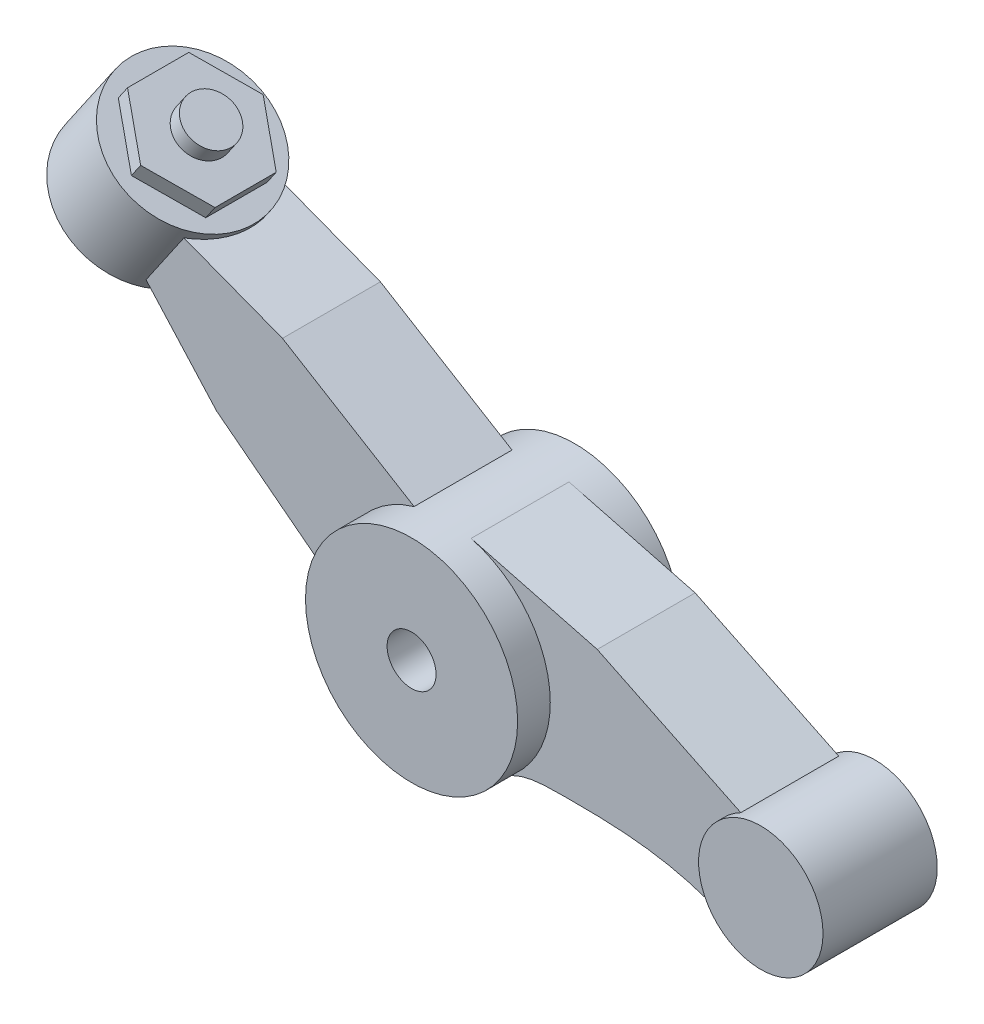
from build123d import *

# Parameters (mm, degrees)
SKETCH1_R           = 0.3
BOSS_EXTRUDE1_DEPTH = 1
BOSS_EXTRUDE2_DEPTH = 0.7
BOSS_EXTRUDE3_DEPTH = 0.6
BOSS_EXTRUDE4_DEPTH = 0.6
BOSS_EXTRUDE5_DEPTH = 0.2
SKETCH5_R           = 0.3
BOSS_EXTRUDE6_DEPTH = 0.2


with BuildPart() as part:
    # Sketch1 → Boss-Extrude1 (new, symmetric)
    with BuildSketch(Plane.XY):
        with BuildLine():
            ThreePointArc((1.3, 0), (1.02910885, 0.794314153), (0.329330809, 1.257593423))
            ThreePointArc((0.329330809, 1.257593423), (-0.020477848, 1.299838705), (-0.368782161, 1.24659525))
            ThreePointArc((-0.368782161, 1.24659525), (-1.071749439, 0.735767042), (-1.295848634, -0.103809043))
            ThreePointArc((-1.295848634, -0.103809043), (-0.542880941, -1.181219829), (0.765101997, -1.051008532))
            ThreePointArc((0.765101997, -1.051008532), (1.158583747, -0.5896471), (1.3, 0))
        make_face()
        Circle(SKETCH1_R, mode=Mode.SUBTRACT)
    extrude(amount=BOSS_EXTRUDE1_DEPTH, both=True)



with BuildPart() as body_2:
    # Sketch1<3> → Boss-Extrude2 (new, symmetric)
    with BuildSketch(Plane.XY):
        with BuildLine():
            ThreePointArc((4.7425, -0.68), (4.378976485, -0.030212331), (3.635027175, 0))
            ThreePointArc((3.635027175, 0), (3.227898468, -0.554502849), (3.432931907, -1.211152286))
            ThreePointArc((3.432931907, -1.211152286), (4.266589278, -1.386592411), (4.7425, -0.68))
        make_face()
    extrude(amount=BOSS_EXTRUDE2_DEPTH, both=True)


with BuildPart() as part_1:
    add(part.part)

    add(body_2.part)  # Boss-Extrude3 merges body 2
    # Sketch1<4> → Boss-Extrude3 (add, symmetric)
    with BuildSketch(Plane.XY):
        with BuildLine():
            ThreePointArc((3.432931907, -1.211152286), (3.227898468, -0.554502849), (3.635027175, 0))
            Line((3.635027175, 0), (1.875255399, 0.852756227))
            Line((1.875255399, 0.852756227), (0.329330809, 1.257593423))
            ThreePointArc((0.329330809, 1.257593423), (1.02910885, 0.794314153), (1.3, 0))
            ThreePointArc((1.3, 0), (1.158583747, -0.5896471), (0.765101997, -1.051008532))
            add(Edge.make_bspline(
                [(3.432931907, -1.211152286), (2.782696134, -0.927463912), (1.92467005, -0.895659575), (0.949941147, -0.916451296), (0.765101997, -1.051008532)],
                knots=[0, 0, 0, 0, 0.749641012, 1, 1, 1, 1], degree=3))
        make_face()
    extrude(amount=BOSS_EXTRUDE3_DEPTH, both=True)

    # Sketch1<5> → Boss-Extrude4 (add, symmetric)
    with BuildSketch(Plane.XY):
        with BuildLine():
            ThreePointArc((-1.295848634, -0.103809043), (-1.071749439, 0.735767042), (-0.368782161, 1.24659525))
            Line((-0.368782161, 1.24659525), (-1.982194984, 2.225541153))
            Line((-1.982194984, 2.225541153), (-3.468005165, 2.793231136))
            Line((-3.468005165, 2.793231136), (-3.852867925, 2.232623737))
            Line((-3.852867925, 2.232623737), (-2.789177956, 1.050055575))
            Line((-2.789177956, 1.050055575), (-1.295848634, -0.103809043))
        make_face()
    extrude(amount=BOSS_EXTRUDE4_DEPTH, both=True)



with BuildPart() as body_2_2:
    # Sketch2 → Revolve1 (revolve)
    with BuildSketch(Plane.XY):
        with BuildLine():
            Line((-3.852867925, 2.232623737), (-3.445366179, 2.826208042))
            Line((-3.445366179, 2.826208042), (-3.771013124, 3.049768027))
            Line((-3.771013124, 3.049768027), (-4.831729785, 1.50468321))
            ThreePointArc((-4.831729785, 1.50468321), (-4.376188277, 1.556125039), (-4.362335635, 2.014352527))
            Line((-4.362335635, 2.014352527), (-3.852867925, 2.232623737))
        make_face()
    revolve(axis=Axis((-3.771013124, 3.049768027, 0), (-0.5659746478395028, -0.8244226452511788, 0)))


with BuildPart() as part_2:
    add(part_1.part)

    add(body_2_2.part)  # Revolve2 merges body 2 2
    # Sketch3 → Revolve2 (revolve)
    with BuildSketch(Plane.XY):
        Polygon((-3.682752686, 3.178331919), (-4.291741407, 2.291253153), (-5.041966015, 2.806290082), (-4.432977294, 3.693368848), align=None)
    revolve(axis=Axis((-3.682752686, 3.178331919, 0), (-0.5659746478395036, -0.8244226452511781, 0)))

    # Sketch4 → Boss-Extrude5 (add, symmetric)
    with BuildSketch(Plane(origin=(0.303330803, 0.441844497, 0), x_dir=(0.824422645251178, -0.5659746478395038, 0), z_dir=(0.5659746478395038, 0.824422645251178, 0))):
        Polygon((-4.835, 0.75055535), (-5.485, 0.375277675), (-5.485, -0.375277675), (-4.835, -0.75055535), (-4.185, -0.375277675), (-4.185, 0.375277675), align=None)
    extrude(amount=BOSS_EXTRUDE5_DEPTH, both=True)

    # Sketch5 → Boss-Extrude6 (add, symmetric)
    with BuildSketch(Plane(origin=(0.416525733, 0.606729026, 0), x_dir=(0.8244226452511778, -0.5659746478395041, 0), z_dir=(0.565974647839504, 0.8244226452511777, 0))):
        with Locations((-4.835, 0)):
            Circle(SKETCH5_R)
    extrude(amount=BOSS_EXTRUDE6_DEPTH, both=True)


solid = part_2.part
